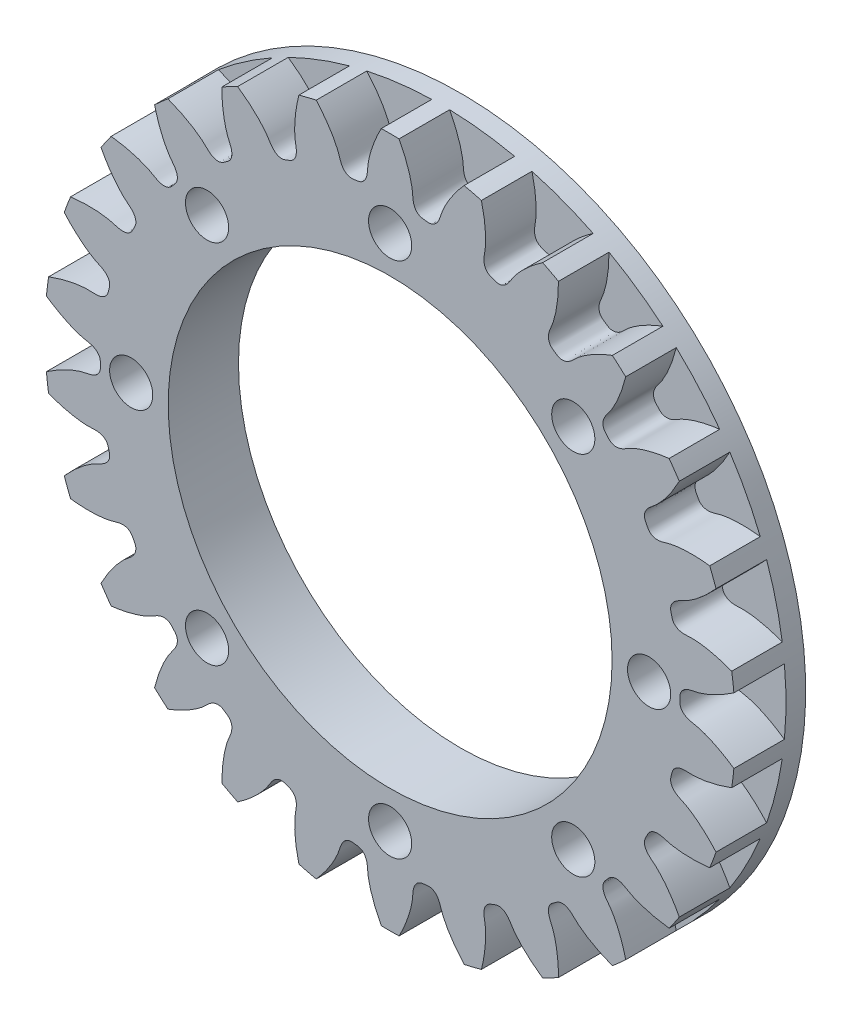
from build123d import *

# Parameters (mm, degrees)
SKETCHREVOLVESPURGEAR2_W       = 4.2
SKETCHREVOLVESPURGEAR2_H       = 27.999999579
TOOTHEXTRUDECUTSPURGEAR2_START = -2
TOOTHEXTRUDECUTSPURGEAR2_DEPTH = 4.1
PATTERNSPURGEAR2_COUNT         = 26
BOREREVOLVESKETCH_W            = 4.2
BOREREVOLVESKETCH_H            = 18
SKETCH1_R                      = 1.75
CUT_EXTRUDE1_DEPTH             = 40.820094989
BOSS_EXTRUDE1_START            = 1.5
SKETCH2_R                      = 28
SKETCH2_R_2                    = 1.75
SKETCH2_R_3                    = 18
BOSS_EXTRUDE1_DEPTH            = 1.5


with BuildPart() as part:
    # SketchRevolveSpurGear2 → SpurGear2 (revolve)
    with BuildSketch(Plane(origin=(0, 0, 0), x_dir=(0, 0, -1), z_dir=(1, 0, 0)), mode=Mode.PRIVATE) as spurgear2_sk:
        with Locations((0, 13.99999979)):
            Rectangle(SKETCHREVOLVESPURGEAR2_W, SKETCHREVOLVESPURGEAR2_H)
    revolve(spurgear2_sk.sketch.rotate(Axis((0, 0, 0), (0, 0, -1)), 90), axis=Axis((0, 0, 0), (0, 0, -1)))

    # SketchToothSpurGear2 → ToothExtrudeCutSpurGear2 (cut)
    with BuildSketch(Plane.XY.offset(TOOTHEXTRUDECUTSPURGEAR2_START)):
        with BuildLine():
            ThreePointArc((27.967931097, 2.721177403), (28.099999578, 0), (27.967931097, -2.721177403))
            add(Edge.make_bspline(
                [(27.967931097, -2.721177403), (27.763754051, -2.577368906), (27.45988226, -2.375317635), (27.054718448, -2.130765319), (26.771509076, -1.970609362), (26.501301853, -1.827769561), (26.244837865, -1.70137092), (26.00281878, -1.590510389), (25.775905859, -1.494258687), (25.564719047, -1.411662356), (25.369836149, -1.341743455), (25.191791925, -1.283507464), (25.031077705, -1.235924829), (24.888139619, -1.19799606), (24.76338134, -1.16855779), (24.569503314, -1.128978605), (24.379567001, -1.099847364), (24.197111023, -1.042982032), (24.096768354, -1.005131229), (23.999822959, -0.96026325), (23.905324291, -0.906606617), (23.812530635, -0.841088441), (23.721549507, -0.759218173), (23.634910547, -0.655094209), (23.559449145, -0.523238068), (23.512243469, -0.373005461), (23.493324541, -0.194778458), (23.503961819, 0), (23.493324541, 0.194778458), (23.512243469, 0.373005461), (23.559449145, 0.523238068), (23.634910547, 0.655094209), (23.721549507, 0.759218173), (23.812530635, 0.841088441), (23.905324291, 0.906606617), (23.999822959, 0.96026325), (24.096768354, 1.005131229), (24.197111023, 1.042982032), (24.379567001, 1.099847364), (24.569503314, 1.128978605), (24.76338134, 1.16855779), (24.888139619, 1.19799606), (25.031077705, 1.235924829), (25.191791925, 1.283507464), (25.369836149, 1.341743455), (25.564719047, 1.411662356), (25.775905859, 1.494258687), (26.00281878, 1.590510389), (26.244837865, 1.70137092), (26.501301853, 1.827769561), (26.771509076, 1.970609362), (27.054718448, 2.130765319), (27.45988226, 2.375317635), (27.763754051, 2.577368906), (27.967931097, 2.721177403)],
                knots=[0, 0, 0, 0, 0.067678545, 0.098846296, 0.128233033, 0.155838755, 0.181663463, 0.205707157, 0.227969837, 0.248451502, 0.267152153, 0.284071789, 0.299210412, 0.31256802, 0.324144614, 0.333940193, 0.36620217, 0.376043063, 0.385676334, 0.395249242, 0.40496248, 0.415086991, 0.425974801, 0.438038627, 0.45164696, 0.466884901, 0.480343723, 0.5, 0.519656277, 0.533115099, 0.54835304, 0.561961373, 0.574025199, 0.584913009, 0.59503752, 0.604750758, 0.614323666, 0.623956937, 0.63379783, 0.666059807, 0.675855386, 0.68743198, 0.700789588, 0.715928211, 0.732847847, 0.751548498, 0.772030163, 0.794292843, 0.818336537, 0.844161245, 0.871766967, 0.901153704, 0.932321455, 1, 1, 1, 1], degree=3))
        make_face()
    toothextrudecutspurgear2 = extrude(amount=TOOTHEXTRUDECUTSPURGEAR2_DEPTH, mode=Mode.SUBTRACT)

    # PatternSpurGear2: ToothExtrudeCutSpurGear2 ×26 about axis
    patternspurgear2_axis = Axis((0, 0, 55), (0, 0, -1))
    for i in range(1, PATTERNSPURGEAR2_COUNT):
        add(toothextrudecutspurgear2.rotate(patternspurgear2_axis, i * 360 / PATTERNSPURGEAR2_COUNT), mode=Mode.SUBTRACT)

    # BoreRevolveSketch → BoreRevolveCut (revolve, cut)
    with BuildSketch(Plane(origin=(0, 0, 0), x_dir=(0, 0, -1), z_dir=(1, 0, 0)), mode=Mode.PRIVATE) as borerevolvecut_sk:
        with Locations((0, 9)):
            Rectangle(BOREREVOLVESKETCH_W, BOREREVOLVESKETCH_H)
    revolve(borerevolvecut_sk.sketch.rotate(Axis((0, 0, 0), (0, 0, -1)), 90), axis=Axis((0, 0, 0), (0, 0, -1)), mode=Mode.SUBTRACT)

    # Sketch1 → Cut-Extrude1 (cut, through all)
    with BuildSketch(Plane(origin=(0, 0, -2.1), x_dir=(-1, 0, 0), z_dir=(0, 0, -1))):
        with Locations((0, 21)):
            Circle(SKETCH1_R)
        with Locations((14.849242405, 14.849242405)):
            Circle(SKETCH1_R)
        with Locations((21, 0)):
            Circle(SKETCH1_R)
        with Locations((14.849242405, -14.849242405)):
            Circle(SKETCH1_R)
        with Locations((0, -21)):
            Circle(SKETCH1_R)
        with Locations((-14.849242405, -14.849242405)):
            Circle(SKETCH1_R)
        with Locations((-21, 0)):
            Circle(SKETCH1_R)
        with Locations((-14.849242405, 14.849242405)):
            Circle(SKETCH1_R)
    extrude(amount=-CUT_EXTRUDE1_DEPTH, mode=Mode.SUBTRACT)

    # Sketch2 → Boss-Extrude1 (add)
    with BuildSketch(Plane(origin=(0, 0, -2.1), x_dir=(-1, 0, 0), z_dir=(0, 0, -1)).offset(BOSS_EXTRUDE1_START)):
        with Locations(Location((0, 0, 0), (0, 0, 185.441980019))):
            Circle(SKETCH2_R)
        with Locations((14.849242405, -14.849242405)):
            Circle(SKETCH2_R_2, mode=Mode.SUBTRACT)
        with Locations((0, -21)):
            Circle(SKETCH2_R_2, mode=Mode.SUBTRACT)
        with Locations((-14.849242405, -14.849242405)):
            Circle(SKETCH2_R_2, mode=Mode.SUBTRACT)
        with Locations((-21, 0)):
            Circle(SKETCH2_R_2, mode=Mode.SUBTRACT)
        with Locations((-14.849242405, 14.849242405)):
            Circle(SKETCH2_R_2, mode=Mode.SUBTRACT)
        with Locations((0, 21)):
            Circle(SKETCH2_R_2, mode=Mode.SUBTRACT)
        with Locations((14.849242405, 14.849242405)):
            Circle(SKETCH2_R_2, mode=Mode.SUBTRACT)
        with Locations((21, 0)):
            Circle(SKETCH2_R_2, mode=Mode.SUBTRACT)
        with Locations(Location((0, 0, 0), (0, 0, 180))):
            Circle(SKETCH2_R_3, mode=Mode.SUBTRACT)
    extrude(amount=-BOSS_EXTRUDE1_DEPTH)


solid = part.part
